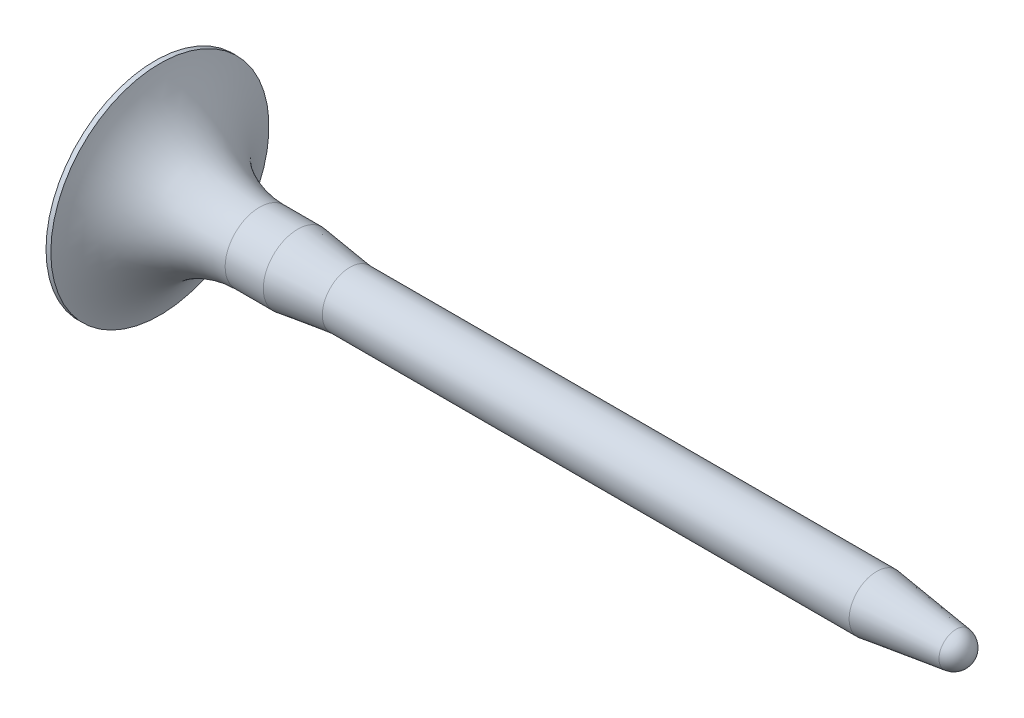
from build123d import *


with BuildPart() as part:
    # Sketch1 → Revolve1 (revolve)
    with BuildSketch(Plane.XY, mode=Mode.PRIVATE) as revolve1_sk:
        with BuildLine():
            Line((0, -4.03225), (0, 0))
            Line((0, 0), (30.1625, 0))
            ThreePointArc((30.1625, 0), (30.004918278, -0.418684593), (29.610384132, -0.629567487))
            Line((29.610384132, -0.629567487), (26.675137782, -1.016))
            Line((26.675137782, -1.016), (7.199821545, -1.016))
            Line((7.199821545, -1.016), (5.2705, -1.27))
            Line((5.2705, -1.27), (3.8608, -1.27))
            ThreePointArc((3.8608, -1.27), (1.558925, -2.037291667), (0.1778, -4.03225))
            Line((0.1778, -4.03225), (0, -4.03225))
        make_face()
    revolve(revolve1_sk.sketch.rotate(Axis((0, 0, 0), (1, 0, 0)), 270), axis=Axis((0, 0, 0), (1, 0, 0)))


solid = part.part
